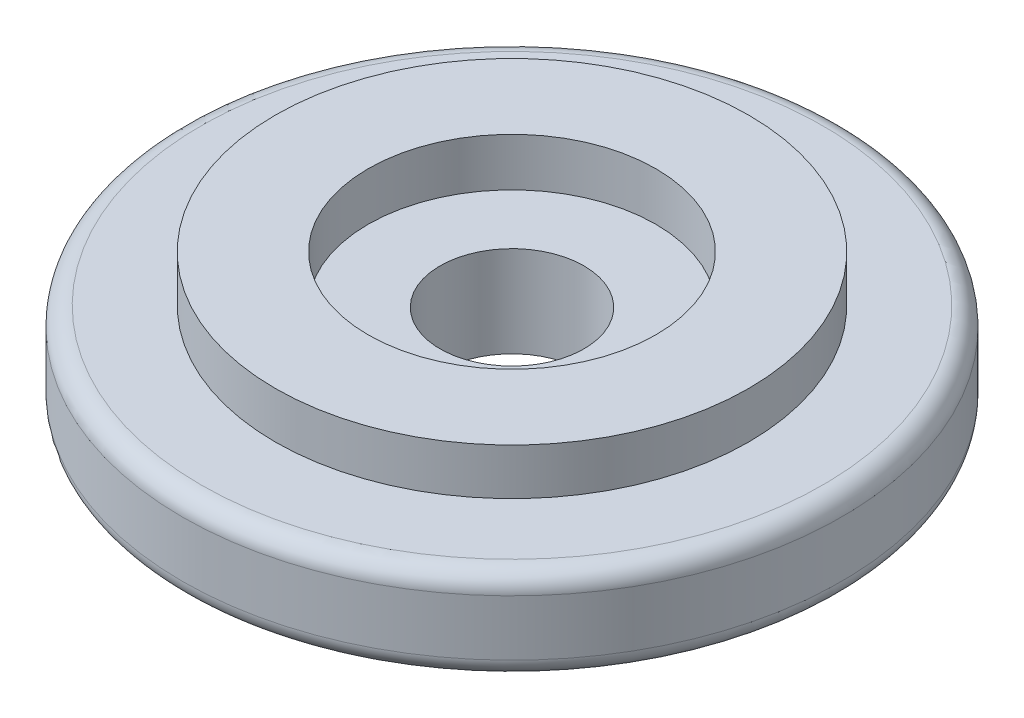
from build123d import *

# Parameters (mm, degrees)
FILLET1_R = 0.4


with BuildPart() as part:
    # Sketch1 → Revolve1 (revolve)
    with BuildSketch(Plane.XY, mode=Mode.PRIVATE) as revolve1_sk:
        Polygon((1.55, 0.202573529), (7.1, 0.202573529), (7.1, 2.202573529), (5.1, 2.202573529), (5.1, 3.202573529), (3.1, 3.202573529), (3.1, 2.165441176), (1.55, 2.165441176), align=None)
    revolve(revolve1_sk.sketch.rotate(Axis((0, 0, 0), (0, 1, 0)), 90), axis=Axis((0, 0, 0), (0, 1, 0)))

    # Fillet1
    fillet1_edges = [part.edges().sort_by_distance(p)[0] for p in [
        (0, 2.202573529, 7.1),
        (0, 0.202573529, 7.1),
    ]]
    fillet(fillet1_edges, radius=FILLET1_R)


solid = part.part
